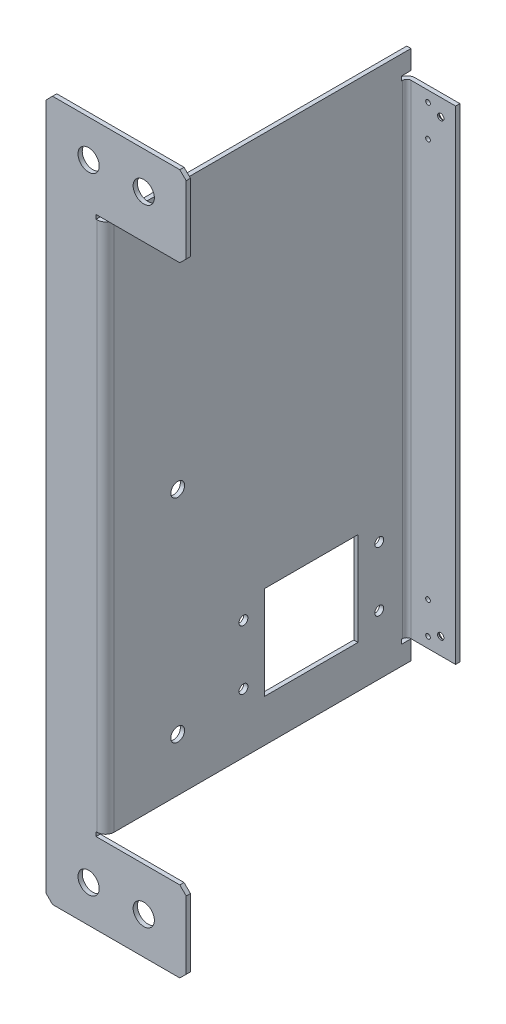
from build123d import *

# Parameters (mm, degrees)
SKETCH_1_R          = 5
EXTRUDE_1_DEPTH     = 2
SKETCH_2_W          = 2
SKETCH_2_H          = 250
EXTRUDE_2_DEPTH     = 144
SKETCH_3_W          = 2
SKETCH_3_H          = 228
EXTRUDE_3_DEPTH     = 23
SKETCH_4_W          = 4.5
SKETCH_4_H          = 2
CUT_EXTRUDE_1_DEPTH = 2
SKETCH_5_W          = 4.5
SKETCH_5_H          = 2
CUT_EXTRUDE_2_DEPTH = 2
FILLET_3_R          = 2
FILLET_4_R          = 4
SKETCH_6_R          = 1.1
SKETCH_6_R_2        = 1.5
CUT_EXTRUDE_3_DEPTH = 2
CHAMFER_1_SIZE      = 1.3
SKETCH_8_R          = 3.25
SKETCH_8_R_2        = 2.1
SKETCH_8_W          = 44
SKETCH_8_H          = 44
CUT_EXTRUDE_4_DEPTH = 2


with BuildPart() as part:
    # Эскиз1 → Вытянуть1 (new body)
    with BuildSketch(Plane.XY):
        Polygon((-15.389384289, -165), (44.610615711, -165), (47.610615711, -162), (47.610615711, -130), (44.610615711, -127), (9.610615711, -127), (9.610615711, 127), (44.610615711, 127), (47.610615711, 130), (47.610615711, 162), (44.610615711, 165), (-15.389384289, 165), (-18.389384289, 162), (-18.389384289, -162), align=None)
        with Locations((1.610615711, -147.5)):
            Circle(SKETCH_1_R, mode=Mode.SUBTRACT)
        with Locations((27.610615711, -147.5)):
            Circle(SKETCH_1_R, mode=Mode.SUBTRACT)
        with Locations(Location((27.610615711, 147.5, 0), (0, 0, 180))):
            Circle(SKETCH_1_R, mode=Mode.SUBTRACT)
        with Locations(Location((1.610615711, 147.5, 0), (0, 0, 180))):
            Circle(SKETCH_1_R, mode=Mode.SUBTRACT)
    extrude(amount=EXTRUDE_1_DEPTH)

    # Эскиз2 → Вытянуть2 (add)
    with BuildSketch(Plane.XY.offset(2)):
        with Locations((8.610615711, 0)):
            Rectangle(SKETCH_2_W, SKETCH_2_H)
    extrude(amount=-EXTRUDE_2_DEPTH)

    # Эскиз3 → Вытянуть3 (add)
    with BuildSketch(Plane(origin=(9.610615711, 0, 0), x_dir=(0, 0, -1), z_dir=(1, 0, 0))):
        with Locations((141, 0)):
            Rectangle(SKETCH_3_W, SKETCH_3_H)
    extrude(amount=EXTRUDE_3_DEPTH)

    # Эскиз4 → Вырез-Вытянуть1 (cut)
    with BuildSketch(Plane.XY.offset(2)):
        with Locations((7.360615711, 126)):
            Rectangle(SKETCH_4_W, SKETCH_4_H)
        with Locations((7.360615711, -126)):
            Rectangle(SKETCH_4_W, SKETCH_4_H)
    extrude(amount=-CUT_EXTRUDE_1_DEPTH, mode=Mode.SUBTRACT)

    # Эскиз5 → Вырез-Вытянуть2 (cut)
    with BuildSketch(Plane(origin=(9.610615711, 0, 0), x_dir=(0, 0, -1), z_dir=(1, 0, 0))):
        with Locations((139.75, -115)):
            Rectangle(SKETCH_5_W, SKETCH_5_H)
        with Locations((139.75, 115)):
            Rectangle(SKETCH_5_W, SKETCH_5_H)
    extrude(amount=-CUT_EXTRUDE_2_DEPTH, mode=Mode.SUBTRACT)

    # Скругление3
    fillet_3_edges = [part.edges().sort_by_distance(p)[0] for p in [
        (9.610615711, 0, -140),
        (7.610615711, 0, 0),
    ]]
    fillet(fillet_3_edges, radius=FILLET_3_R)

    # Скругление4
    fillet_4_edges = [part.edges().sort_by_distance(p)[0] for p in [
        (7.610615711, 0, -142),
        (9.610615711, 0, 2),
    ]]
    fillet(fillet_4_edges, radius=FILLET_4_R)

    # Эскиз6 → Вырез-Вытянуть3 (cut)
    with BuildSketch(Plane(origin=(0, 0, -142), x_dir=(-1, 0, 0), z_dir=(0, 0, -1))):
        with Locations(Location((-19.610615711, -94, 0), (0, 0, 180))):
            Circle(SKETCH_6_R)
        with Locations((-25.610615711, -106)):
            Circle(SKETCH_6_R_2)
        with Locations((-25.610615711, 106)):
            Circle(SKETCH_6_R_2)
        with Locations(Location((-19.610615711, -109, 0), (0, 0, 180))):
            Circle(SKETCH_6_R)
        with Locations((-19.610615711, 109)):
            Circle(SKETCH_6_R)
        with Locations((-19.610615711, 94)):
            Circle(SKETCH_6_R)
    extrude(amount=-CUT_EXTRUDE_3_DEPTH, mode=Mode.SUBTRACT)

    # Фаска1
    chamfer_1_edges = [part.edges().sort_by_distance(p)[0] for p in [
        (27.110615711, -106, -142),
        (27.110615711, 106, -142),
    ]]
    chamfer(chamfer_1_edges, length=CHAMFER_1_SIZE)

    # Эскиз8 → Вырез-Вытянуть4 (cut)
    with BuildSketch(Plane(origin=(9.610615711, 0, 0), x_dir=(0, 0, -1), z_dir=(1, 0, 0))):
        with Locations((32, 0)):
            Circle(SKETCH_8_R)
        with Locations((32, -100)):
            Circle(SKETCH_8_R)
        with Locations(Location((32, 100, 0), (0, 0, 180))):
            Circle(SKETCH_8_R)
        with Locations((63, -97)):
            Circle(SKETCH_8_R_2)
        with Locations((127, -97)):
            Circle(SKETCH_8_R_2)
        with Locations((127, -69)):
            Circle(SKETCH_8_R_2)
        with Locations((63, -69)):
            Circle(SKETCH_8_R_2)
        with Locations((95, -83)):
            Rectangle(SKETCH_8_W, SKETCH_8_H)
    extrude(amount=-CUT_EXTRUDE_4_DEPTH, mode=Mode.SUBTRACT)


solid = part.part
